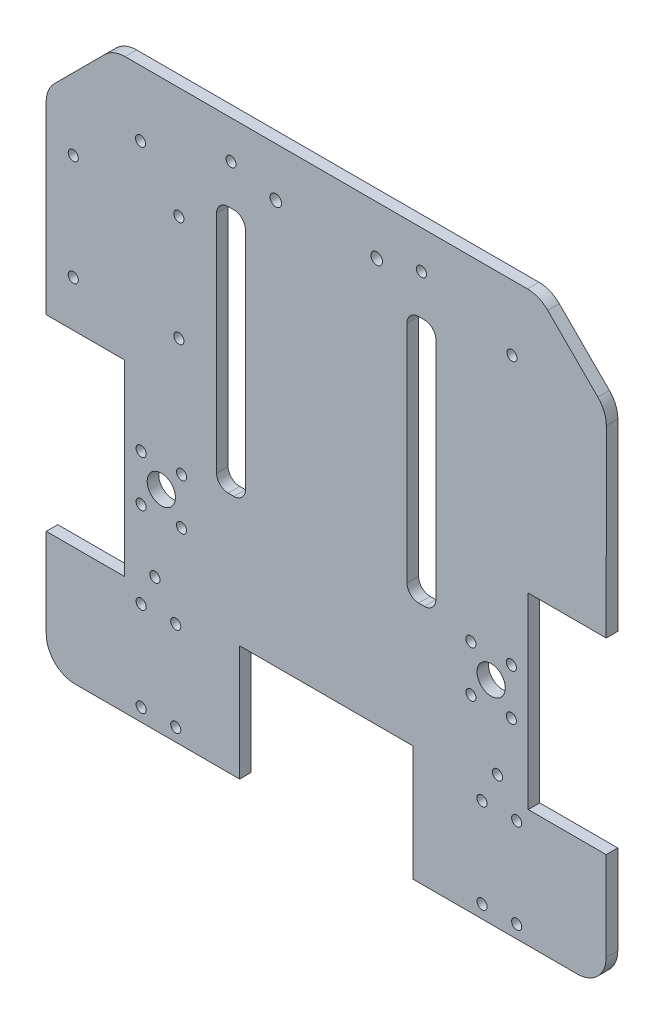
from build123d import *

# Parameters (mm, degrees)
EXTRUDE_1_DEPTH      = 4
L298N_R              = 1.75
CUT_EXTRUDE_5_DEPTH  = 10
SKETCH_583_R         = 1.75
CUT_EXTRUDE_7_DEPTH  = 10
SKETCH_1386_W        = 40
SKETCH_1386_H        = 65
CUT_EXTRUDE_8_DEPTH  = 10
SKETCH_4195_R        = 2
CUT_EXTRUDE_10_DEPTH = 10
SKETCH_2209_R        = 1.75
SKETCH_2209_R_2      = 4.9
CUT_EXTRUDE_3_DEPTH  = 10
CUT_EXTRUDE_11_REACH = 358.759
SKETCH_11_R          = 1.75
SKETCH_12_W          = 60
SKETCH_12_H          = 40
SKETCH_12_H_2        = 10
CUT_EXTRUDE_12_DEPTH = 10
SKETCH_13_R          = 1.75
CUT_EXTRUDE_14_DEPTH = 357.758930871
SKETCH_14_R          = 1.75
CUT_EXTRUDE_15_DEPTH = 10
CUT_EXTRUDE_16_DEPTH = 10
CUT_EXTRUDE_17_DEPTH = 10


with BuildPart() as part:
    # 草图3 → 凸台-拉伸1 (new body)
    with BuildSketch(Plane.XY):
        with BuildLine():
            Line((73.505746565, 259.089488009), (196.937204075, 259.089488009))
            ThreePointArc((196.937204075, 259.089488009), (204.590872722, 257.56707866), (211.079339699, 253.231623633))
            Line((211.079339699, 253.231623633), (239.363610946, 224.947352386))
            ThreePointArc((239.363610946, 224.947352386), (243.699065973, 218.458885409), (245.221475323, 210.805216762))
            Line((245.221475323, 210.805216762), (245.221475323, 54.089488009))
            ThreePointArc((245.221475323, 54.089488009), (239.363610946, 39.947352386), (225.221475323, 34.089488009))
            Line((225.221475323, 34.089488009), (45.221475318, 34.089488009))
            ThreePointArc((45.221475318, 34.089488009), (31.079339694, 39.947352386), (25.221475318, 54.089488009))
            Line((25.221475318, 54.089488009), (25.221475318, 210.805216762))
            ThreePointArc((25.221475318, 210.805216762), (26.743884667, 218.458885409), (31.079339694, 224.947352386))
            Line((31.079339694, 224.947352386), (59.363610941, 253.231623633))
            ThreePointArc((59.363610941, 253.231623633), (65.852077918, 257.56707866), (73.505746565, 259.089488009))
        make_face()
    extrude(amount=EXTRUDE_1_DEPTH)

    # L298N → 切除-拉伸5 (cut)
    with BuildSketch(Plane.XY):
        with Locations((47.555746565, 165.855216762)):
            Circle(L298N_R)
        with Locations((47.555746565, 202.455216762)):
            Circle(L298N_R)
        with Locations((84.155746565, 202.455216762)):
            Circle(L298N_R)
        with Locations((84.155746565, 165.855216762)):
            Circle(L298N_R)
    extrude(amount=CUT_EXTRUDE_5_DEPTH, mode=Mode.SUBTRACT)

    # Sketch 583 → 切除-拉伸7 (cut)
    with BuildSketch(Plane.XY):
        with Locations((168.22147532, 227.947352386)):
            Circle(SKETCH_583_R)
        with Locations(Location((168.22147532, 151.947352386, 0), (0, 0, 180))):
            Circle(SKETCH_583_R)
        with Locations((102.22147532, 151.947352386)):
            Circle(SKETCH_583_R)
        with Locations(Location((102.22147532, 227.947352386, 0), (0, 0, 180))):
            Circle(SKETCH_583_R)
    extrude(amount=CUT_EXTRUDE_7_DEPTH, mode=Mode.SUBTRACT)

    # Sketch 1386 → 切除-拉伸8 (cut)
    with BuildSketch(Plane.XY.offset(4)):
        with Locations((225.221475323, 117.447352386)):
            Rectangle(SKETCH_1386_W, SKETCH_1386_H)
        with Locations((45.221475318, 117.447352386)):
            Rectangle(SKETCH_1386_W, SKETCH_1386_H)
    extrude(amount=-CUT_EXTRUDE_8_DEPTH, mode=Mode.SUBTRACT)

    # Sketch 4195 → 切除-拉伸10 (cut)
    with BuildSketch(Plane.XY):
        with Locations((117.72147532, 224.089488009)):
            Circle(SKETCH_4195_R)
        with Locations((152.72147532, 224.089488009)):
            Circle(SKETCH_4195_R)
    extrude(amount=CUT_EXTRUDE_10_DEPTH, mode=Mode.SUBTRACT)

    # Sketch 2209 → 切除-拉伸3 (cut)
    with BuildSketch(Plane.XY):
        with Locations(Location((185.371475323, 109.447352386, 0), (0, 0, 180))):
            Circle(SKETCH_2209_R)
        with Locations((199.371475323, 125.447352386)):
            Circle(SKETCH_2209_R)
        with Locations((192.371475323, 117.447352386)):
            Circle(SKETCH_2209_R_2)
        with Locations((185.371475323, 125.447352386)):
            Circle(SKETCH_2209_R)
        with Locations(Location((199.371475323, 109.447352386, 0), (0, 0, 180))):
            Circle(SKETCH_2209_R)
        with Locations((71.071475318, 109.447352386)):
            Circle(SKETCH_2209_R)
        with Locations(Location((85.071475318, 125.447352386, 0), (0, 0, 180))):
            Circle(SKETCH_2209_R)
        with Locations(Location((78.071475318, 117.447352386, 0), (0, 0, 180))):
            Circle(SKETCH_2209_R_2)
        with Locations(Location((71.071475318, 125.447352386, 0), (0, 0, 180))):
            Circle(SKETCH_2209_R)
        with Locations((85.071475318, 109.447352386)):
            Circle(SKETCH_2209_R)
    extrude(amount=CUT_EXTRUDE_3_DEPTH, mode=Mode.SUBTRACT)

    # 草图11 → 切除-拉伸11 (cut, up to next)
    with BuildSketch(Plane.XY.offset(4), mode=Mode.PRIVATE) as cut_extrude_11_sk1:
        with Locations((75.852077918, 90.089488009)):
            Circle(SKETCH_11_R)
    cut_extrude_11_tool1 = extrude(cut_extrude_11_sk1.sketch, amount=-CUT_EXTRUDE_11_REACH, mode=Mode.PRIVATE) & part.part
    # 草图11 → 切除-拉伸11 (cut, up to next)
    with BuildSketch(Plane.XY.offset(4), mode=Mode.PRIVATE) as cut_extrude_11_sk2:
        with Locations((70.852077918, 218.458885409)):
            Circle(SKETCH_11_R)
    cut_extrude_11_tool2 = extrude(cut_extrude_11_sk2.sketch, amount=-CUT_EXTRUDE_11_REACH, mode=Mode.PRIVATE) & part.part
    # 草图11 → 切除-拉伸11 (cut, up to next)
    with BuildSketch(Plane.XY.offset(4), mode=Mode.PRIVATE) as cut_extrude_11_sk3:
        with Locations((199.590872722, 218.458885409)):
            Circle(SKETCH_11_R)
    cut_extrude_11_tool3 = extrude(cut_extrude_11_sk3.sketch, amount=-CUT_EXTRUDE_11_REACH, mode=Mode.PRIVATE) & part.part
    # 草图11 → 切除-拉伸11 (cut, up to next)
    with BuildSketch(Plane.XY.offset(4), mode=Mode.PRIVATE) as cut_extrude_11_sk4:
        with Locations((194.590872722, 90.089488009)):
            Circle(SKETCH_11_R)
    cut_extrude_11_tool4 = extrude(cut_extrude_11_sk4.sketch, amount=-CUT_EXTRUDE_11_REACH, mode=Mode.PRIVATE) & part.part
    add(cut_extrude_11_tool1.solids().sort_by_distance((75.852078, 90.089488, 4))[0], mode=Mode.SUBTRACT)
    add(cut_extrude_11_tool2.solids().sort_by_distance((70.852078, 218.458885, 4))[0], mode=Mode.SUBTRACT)
    add(cut_extrude_11_tool3.solids().sort_by_distance((199.590873, 218.458885, 4))[0], mode=Mode.SUBTRACT)
    add(cut_extrude_11_tool4.solids().sort_by_distance((194.590873, 90.089488, 4))[0], mode=Mode.SUBTRACT)

    # 草图12 → 切除-拉伸12 (cut)
    with BuildSketch(Plane.XY.offset(4)):
        with Locations((135.22147532, 54.089488009)):
            Rectangle(SKETCH_12_W, SKETCH_12_H)
        with Locations((135.22147532, 79.089488009)):
            Rectangle(SKETCH_12_W, SKETCH_12_H_2)
    extrude(amount=-CUT_EXTRUDE_12_DEPTH, mode=Mode.SUBTRACT)

    # 草图13 → 切除-拉伸14 (cut, through all)
    with BuildSketch(Plane.XY.offset(4)):
        with Locations((83.07147532, 48.589488009)):
            Circle(SKETCH_13_R)
        with Locations((71.07147532, 48.589488009)):
            Circle(SKETCH_13_R)
        with Locations(Location((71.07147532, 79.589488009, 0), (0, 0, 180))):
            Circle(SKETCH_13_R)
        with Locations(Location((83.07147532, 79.589488009, 0), (0, 0, 180))):
            Circle(SKETCH_13_R)
        with Locations((189.22147532, 79.589488009)):
            Circle(SKETCH_13_R)
        with Locations((201.22147532, 79.589488009)):
            Circle(SKETCH_13_R)
        with Locations(Location((201.22147532, 48.589488009, 0), (0, 0, 180))):
            Circle(SKETCH_13_R)
        with Locations(Location((189.22147532, 48.589488009, 0), (0, 0, 180))):
            Circle(SKETCH_13_R)
    extrude(amount=-CUT_EXTRUDE_14_DEPTH, mode=Mode.SUBTRACT)

    # 草图14 → 切除-拉伸15 (cut)
    with BuildSketch(Plane.XY.offset(4)):
        with BuildLine():
            Line((103.22147532, 213.947352386), (101.22147532, 213.947352386))
            ThreePointArc((101.22147532, 213.947352386), (98.393048195, 212.77577951), (97.22147532, 209.947352386))
            Line((97.22147532, 209.947352386), (97.22147532, 131.947352386))
            ThreePointArc((97.22147532, 131.947352386), (98.393048195, 129.118925261), (101.22147532, 127.947352386))
            Line((101.22147532, 127.947352386), (103.22147532, 127.947352386))
            ThreePointArc((103.22147532, 127.947352386), (106.049902445, 129.118925261), (107.22147532, 131.947352386))
            Line((107.22147532, 131.947352386), (107.22147532, 209.947352386))
            ThreePointArc((107.22147532, 209.947352386), (106.049902445, 212.77577951), (103.22147532, 213.947352386))
        make_face()
        with BuildLine():
            Line((167.22147532, 213.947352386), (169.22147532, 213.947352386))
            ThreePointArc((169.22147532, 213.947352386), (172.049902445, 212.77577951), (173.22147532, 209.947352386))
            Line((173.22147532, 209.947352386), (173.22147532, 131.947352386))
            ThreePointArc((173.22147532, 131.947352386), (172.049902445, 129.118925261), (169.22147532, 127.947352386))
            Line((169.22147532, 127.947352386), (167.22147532, 127.947352386))
            ThreePointArc((167.22147532, 127.947352386), (164.393048195, 129.118925261), (163.22147532, 131.947352386))
            Line((163.22147532, 131.947352386), (163.22147532, 209.947352386))
            ThreePointArc((163.22147532, 209.947352386), (164.393048195, 212.77577951), (167.22147532, 213.947352386))
        make_face()
        with Locations((102.22147532, 207.947352386)):
            Circle(SKETCH_14_R)
    extrude(amount=-CUT_EXTRUDE_15_DEPTH, mode=Mode.SUBTRACT)

    # 草图16 → 切除-拉伸16 (cut)
    with BuildSketch(Plane.XY):
        with BuildLine():
            Line((38.186724359, 149.947352386), (38.152623691, 213.731017405))
            ThreePointArc((38.152623691, 213.731017405), (38.912804296, 217.560728224), (41.08155445, 220.807431517))
            Line((41.08155445, 220.807431517), (58.434678753, 238.160555821))
            ThreePointArc((58.434678753, 238.160555821), (61.678912242, 240.328283334), (65.505746565, 241.089488009))
            Line((65.505746565, 241.089488009), (204.937204075, 241.089488009))
            ThreePointArc((204.937204075, 241.089488009), (208.764038399, 240.328283334), (212.008271887, 238.160555821))
            Line((212.008271887, 238.160555821), (229.361396191, 220.807431517))
            ThreePointArc((229.361396191, 220.807431517), (231.530146344, 217.560728224), (232.29032695, 213.731017405))
            Line((232.29032695, 213.731017405), (232.256226281, 149.947352386))
            Line((232.256226281, 149.947352386), (245.221475323, 149.947352386))
            Line((245.221475323, 149.947352386), (245.221475323, 210.805216762))
            ThreePointArc((245.221475323, 210.805216762), (243.699065973, 218.458885409), (239.363610946, 224.947352386))
            Line((239.363610946, 224.947352386), (211.079339699, 253.231623633))
            ThreePointArc((211.079339699, 253.231623633), (204.590872722, 257.56707866), (196.937204075, 259.089488009))
            Line((196.937204075, 259.089488009), (73.505746565, 259.089488009))
            ThreePointArc((73.505746565, 259.089488009), (65.852077918, 257.56707866), (59.363610941, 253.231623633))
            Line((59.363610941, 253.231623633), (31.079339694, 224.947352386))
            ThreePointArc((31.079339694, 224.947352386), (26.743884667, 218.458885409), (25.221475318, 210.805216762))
            Line((25.221475318, 210.805216762), (25.221475318, 149.947352386))
            Line((25.221475318, 149.947352386), (38.186724359, 149.947352386))
        make_face()
    extrude(amount=CUT_EXTRUDE_16_DEPTH, mode=Mode.SUBTRACT)

    # 草图18 → 切除-拉伸17 (cut)
    with BuildSketch(Plane.XY):
        with BuildLine():
            Line((48.186724359, 44.089488009), (95.22147532, 44.089488009))
            Line((95.22147532, 44.089488009), (105.22147532, 44.089488009))
            Line((105.22147532, 44.089488009), (105.22147532, 34.089488009))
            Line((105.22147532, 34.089488009), (45.221475318, 34.089488009))
            ThreePointArc((45.221475318, 34.089488009), (31.079339694, 39.947352386), (25.221475318, 54.089488009))
            Line((25.221475318, 54.089488009), (25.221475318, 84.947352386))
            Line((25.221475318, 84.947352386), (38.186724359, 84.947352386))
            Line((38.186724359, 84.947352386), (38.186724359, 54.089488009))
            ThreePointArc((38.186724359, 54.089488009), (41.115656548, 47.018420197), (48.186724359, 44.089488009))
        make_face()
        with BuildLine():
            Line((175.22147532, 44.089488009), (222.256226281, 44.089488009))
            ThreePointArc((222.256226281, 44.089488009), (229.327294093, 47.018420197), (232.256226281, 54.089488009))
            Line((232.256226281, 54.089488009), (232.256226281, 84.947352386))
            Line((232.256226281, 84.947352386), (245.221475323, 84.947352386))
            Line((245.221475323, 84.947352386), (245.221475323, 54.089488009))
            ThreePointArc((245.221475323, 54.089488009), (239.363610946, 39.947352386), (225.221475323, 34.089488009))
            Line((225.221475323, 34.089488009), (165.22147532, 34.089488009))
            Line((165.22147532, 34.089488009), (165.22147532, 44.089488009))
            Line((165.22147532, 44.089488009), (175.22147532, 44.089488009))
        make_face()
    extrude(amount=CUT_EXTRUDE_17_DEPTH, mode=Mode.SUBTRACT)


solid = part.part
